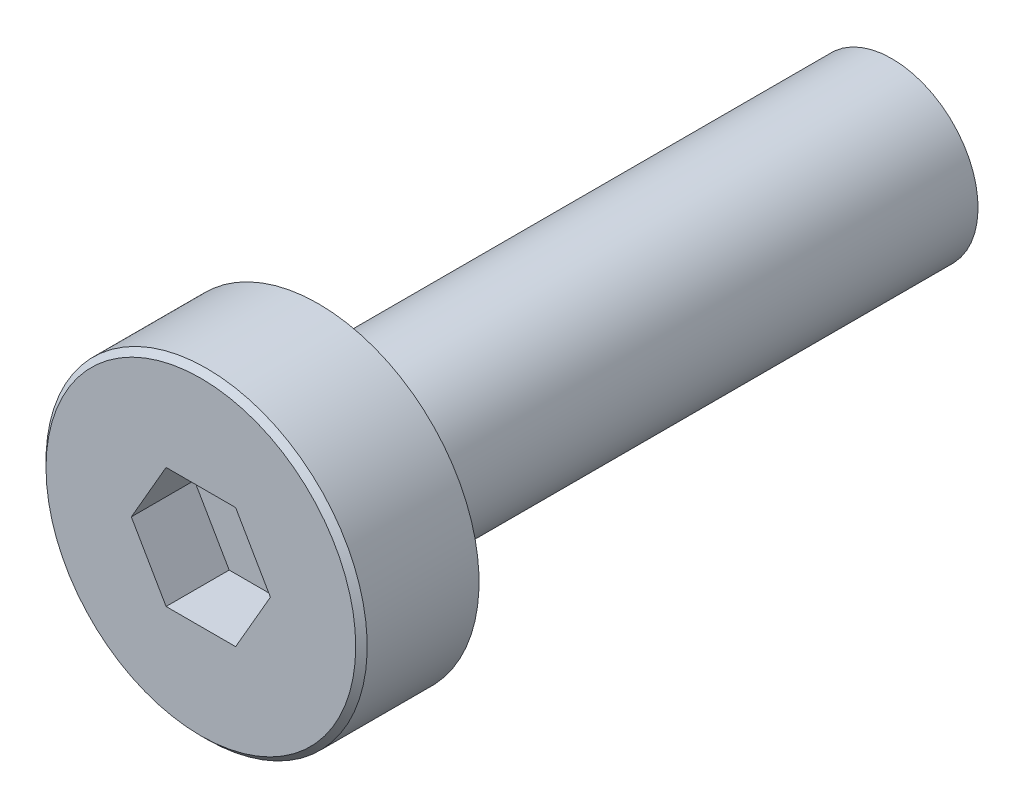
from build123d import *

# Parameters (mm, degrees)
CUT_EXTRUDE_1_DEPTH = 1.1
CHAMFER_579_SIZE    = 0.1


with BuildPart() as part:
    # 草图1 → 旋转1 (revolve)
    with BuildSketch(Plane(origin=(0, 0, 0), x_dir=(0, 0, -1), z_dir=(1, 0, 0))):
        Polygon((0, 0), (0, 2.8), (2.05, 2.8), (2.05, 1.5), (12.05, 1.5), (12.05, 0), align=None)
    revolve(axis=Axis((0, 0, -12.05), (0, 0, 1)))

    # 草图2 → 切除-拉伸1 (cut)
    with BuildSketch(Plane.XY):
        Polygon((0.606217783, 1.05), (-0.606217783, 1.05), (-1.212435565, 0), (-0.606217783, -1.05), (0.606217783, -1.05), (1.212435565, 0), align=None)
    extrude(amount=-CUT_EXTRUDE_1_DEPTH, mode=Mode.SUBTRACT)

    # Chamfer 579
    chamfer_579_edges = [part.edges().sort_by_distance(p)[0] for p in [
        (0, -2.8, 0),
    ]]
    chamfer(chamfer_579_edges, length=CHAMFER_579_SIZE)


solid = part.part
